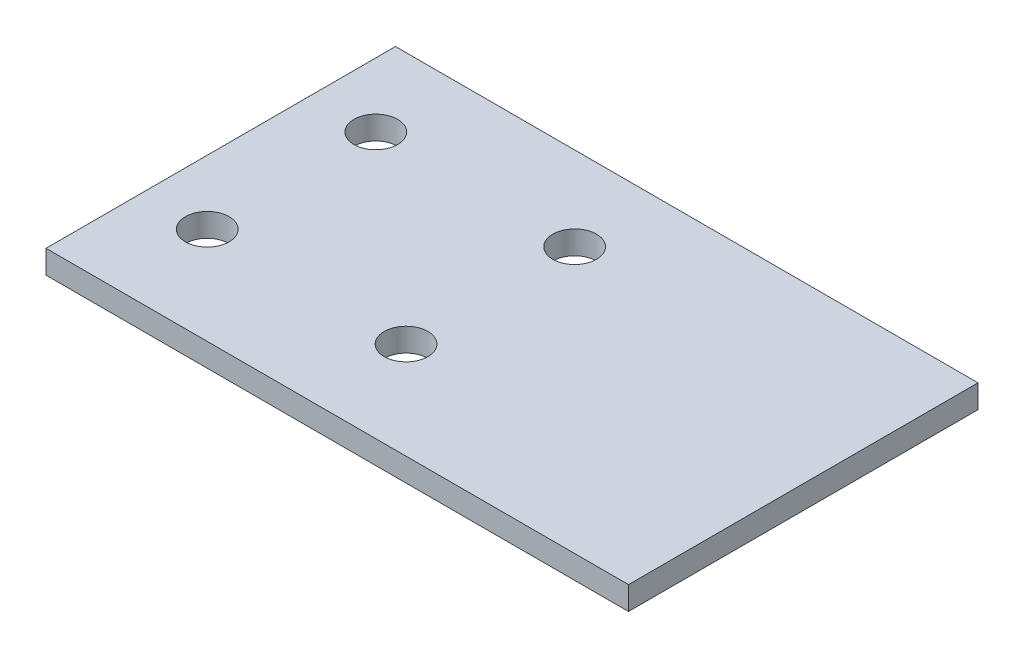
from build123d import *

# Parameters (mm, degrees)
SKETCH1_W                    = 127
SKETCH1_H                    = 76.2
BOSS_EXTRUDE1_DEPTH          = 5.08
F_3_8_0_375_DIAMETER_HOLE1_D = 9.525


with BuildPart() as part:
    # Sketch1 → Boss-Extrude1 (new body)
    with BuildSketch(Plane(origin=(0, 0, 0), x_dir=(1, 0, 0), z_dir=(0, 1, 0))):
        Rectangle(SKETCH1_W, SKETCH1_H)
    extrude(amount=BOSS_EXTRUDE1_DEPTH)

    # 3/8 (0.375) Diameter Hole1 (through all)
    with Locations(Plane(origin=(0, 5.08, 0), x_dir=(-1, 0, 0), z_dir=(0, 1, 0))):
        with Locations((49.518306376, -19.821698769), (49.518306376, 16.929403598), (6.167545908, 16.929403598), (6.167545908, -19.821698769)):
            Hole(F_3_8_0_375_DIAMETER_HOLE1_D / 2)


solid = part.part
